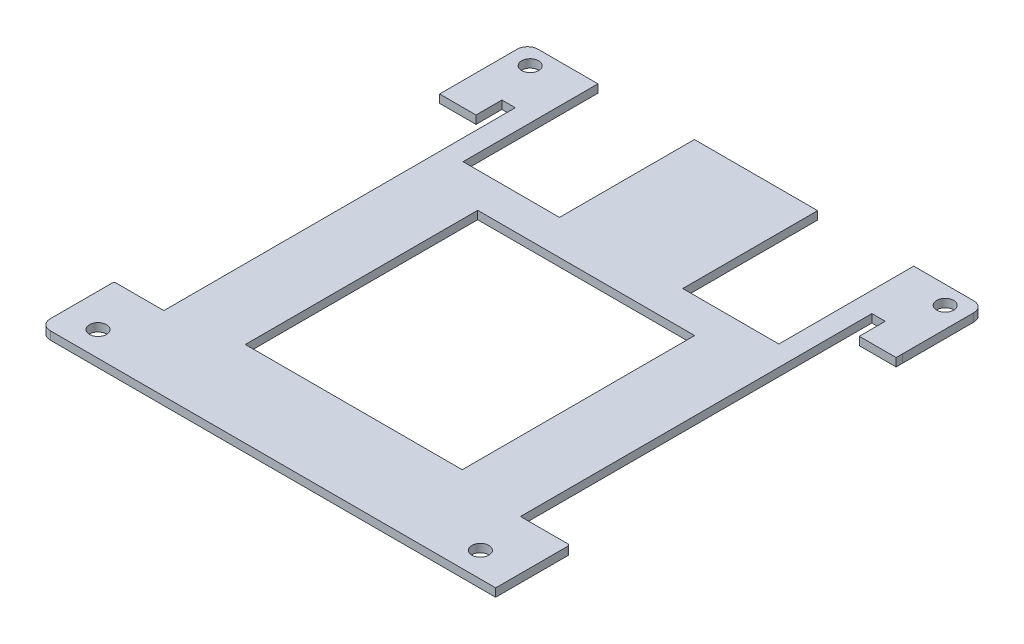
from build123d import *

# Parameters (mm, degrees)
SKETCH1_R                        = 1.6383
BOSS_EXTRUDE1_DEPTH              = 1.575
CUT_EXTRUDE1_DEPTH               = 2.54
CUTOUTS_FOR_THRUSTER_HEADS_DEPTH = 1.575
NOTCH_FOR_BPR_TOP_VIEW_W         = 2.575
NOTCH_FOR_BPR_TOP_VIEW_H         = 6.27
CUT_EXTRUDE11_DEPTH              = 10
NOTCH_FOR_BPL_TOP_VIEW_W         = 2.575
NOTCH_FOR_BPL_TOP_VIEW_H         = 6.27
CUT_EXTRUDE12_DEPTH              = 65.400936523
SKETCH22_W                       = 1.501374709
SKETCH22_H                       = 61.468
SKETCH22_W_2                     = 1.585
BOSS_EXTRUDE2_DEPTH              = 1.575
SKETCH23_W                       = 7.1002401
SKETCH23_H                       = 1.27
SKETCH23_W_2                     = 7.016
CUT_EXTRUDE13_DEPTH              = 65.400936523
SKETCH25_W                       = 2.5
SKETCH25_H                       = 44.79544
BOSS_EXTRUDE3_DEPTH              = 1.575
SKETCH26_W                       = 2.5
SKETCH26_H                       = 44.79544
BOSS_EXTRUDE4_DEPTH              = 1.575
SKETCH27_W                       = 41.818
SKETCH27_H                       = 1
CUT_EXTRUDE15_DEPTH              = 65.400936523
SKETCH28_W                       = 41.818
SKETCH28_H                       = 1
BOSS_EXTRUDE5_DEPTH              = 1.575


with BuildPart() as part:
    # Sketch1 → Boss-Extrude1 (new body)
    with BuildSketch(Plane(origin=(0, 0, 0), x_dir=(1, 0, 0), z_dir=(0, 1, 0))):
        with BuildLine():
            Line((-44, 45), (-44, 29.162404323))
            ThreePointArc((-44, 29.162404323), (-43.886381258, 28.888104416), (-43.612081351, 28.774485674))
            Line((-43.612081351, 28.774485674), (-33.211918649, 28.774485674))
            ThreePointArc((-33.211918649, 28.774485674), (-32.937618742, 28.660866933), (-32.824, 28.386567026))
            Line((-32.824, 28.386567026), (-32.824, -32.305595677))
            ThreePointArc((-32.824, -32.305595677), (-32.937618742, -32.579895584), (-33.211918649, -32.693514326))
            Line((-33.211918649, -32.693514326), (-36.100000052, -32.693514326))
            Line((-36.100000052, -32.693514326), (-43.612081299, -32.693514326))
            ThreePointArc((-43.612081299, -32.693514326), (-43.886381206, -32.807133067), (-43.999999948, -33.081432974))
            Line((-43.999999948, -33.081432974), (-43.999999948, -38.977))
            Line((-43.999999948, -38.977), (-43.999999948, -45))
            ThreePointArc((-43.999999948, -45), (-43.41421351, -46.414213562), (-41.999999948, -47))
            Line((-41.999999948, -47), (42.705916546, -47))
            Line((42.705916546, -47), (43.849731117, -47))
            Line((43.849731117, -47), (43.849731117, -38.27))
            Line((43.849731117, -38.27), (43.849731117, -33.081432974))
            ThreePointArc((43.849731117, -33.081432974), (43.736112376, -32.807133067), (43.461812469, -32.693514326))
            Line((43.461812469, -32.693514326), (36.098785193, -32.693514326))
            Line((36.098785193, -32.693514326), (33.824, -32.693514326))
            Line((33.824, -32.693514326), (32.822785141, -32.693514326))
            Line((32.822785141, -32.693514326), (32.822785141, -30.469351623))
            Line((32.822785141, -30.469351623), (32.822785141, 27.774485674))
            ThreePointArc((32.822785141, 27.774485674), (33.11567836, 28.481592456), (33.822785141, 28.774485674))
            Line((33.822785141, 28.774485674), (43.611054239, 28.774485674))
            ThreePointArc((43.611054239, 28.774485674), (43.885287743, 28.88803803), (43.998972842, 29.162216531))
            Line((43.998972842, 29.162216531), (44, 31.284))
            Line((44, 31.284), (44, 45))
            ThreePointArc((44, 45), (43.414213562, 46.414213562), (42, 47))
            Line((42, 47), (-42, 47))
            ThreePointArc((-42, 47), (-43.414213562, 46.414213562), (-44, 45))
        make_face()
        with Locations(Location((40, 43.5, 0), (0, 0, 270))):
            Circle(SKETCH1_R, mode=Mode.SUBTRACT)
        with Locations(Location((-40, 43.5, 0), (0, 0, 270))):
            Circle(SKETCH1_R, mode=Mode.SUBTRACT)
        with Locations(Location((-37.599999948, -42.2, 0), (0, 0, 270))):
            Circle(SKETCH1_R, mode=Mode.SUBTRACT)
        with Locations(Location((36.100000052, -42.2, 0), (0, 0, 270))):
            Circle(SKETCH1_R, mode=Mode.SUBTRACT)
        Polygon((23.409, -31.5), (-23.409, -31.5), (-23.409, 13.29544), (-12.909, 13.29544), (-12.909, 25.99544), (12.909, 25.99544), (12.909, 13.29544), (23.409, 13.29544), align=None, mode=Mode.SUBTRACT)
    extrude(amount=BOSS_EXTRUDE1_DEPTH)

    # Sketch2 → Cut-Extrude1 (cut)
    with BuildSketch(Plane(origin=(0, 1.575, 0), x_dir=(1, 0, 0), z_dir=(0, 1, 0))):
        Polygon((-12.909, 19.06), (-30.435, 19.06), (-30.435, 47), (30.435, 47), (30.435, 19.06), (12.909, 19.06), (12.909, 25.99544), (-12.909, 25.99544), align=None)
    extrude(amount=-CUT_EXTRUDE1_DEPTH, mode=Mode.SUBTRACT)

    # Sketch16 → Cutouts for Thruster Heads (add)
    with BuildSketch(Plane(origin=(0, 1.575, 0), x_dir=(1, 0, 0), z_dir=(0, 1, 0))):
        Polygon((12.909, 19.06), (12.909, 13.29544), (-12.909, 13.29544), (-12.909, 19.06), (-30.435, 19.06), (-30.435, 21), (-11.838888217, 21), (-11.838888217, 47), (11.909, 47), (11.909, 21), (30.435, 21), (30.435, 19.06), align=None)
    extrude(amount=-CUTOUTS_FOR_THRUSTER_HEADS_DEPTH)

    # Notch for BPR (TOP VIEW) → Cut-Extrude11 (cut)
    with BuildSketch(Plane(origin=(0, 1.575, 0), x_dir=(1, 0, 0), z_dir=(0, 1, 0))):
        with Locations((-35.6965, 31.909485674)):
            Rectangle(NOTCH_FOR_BPR_TOP_VIEW_W, NOTCH_FOR_BPR_TOP_VIEW_H)
    extrude(amount=-CUT_EXTRUDE11_DEPTH, mode=Mode.SUBTRACT)

    # Notch for BPL (TOP VIEW) → Cut-Extrude12 (cut, through all)
    with BuildSketch(Plane(origin=(0, 1.575, 0), x_dir=(1, 0, 0), z_dir=(0, 1, 0))):
        with Locations((35.61165985, 31.909485674)):
            Rectangle(NOTCH_FOR_BPL_TOP_VIEW_W, NOTCH_FOR_BPL_TOP_VIEW_H)
    extrude(amount=-CUT_EXTRUDE12_DEPTH, mode=Mode.SUBTRACT)

    # Sketch22 → Boss-Extrude2 (add)
    with BuildSketch(Plane(origin=(0, 1.575, 0), x_dir=(1, 0, 0), z_dir=(0, 1, 0))):
        with Locations((33.573472495, -1.959514326)):
            Rectangle(SKETCH22_W, SKETCH22_H)
        with Locations((-33.6165, -1.959514326)):
            Rectangle(SKETCH22_W_2, SKETCH22_H)
    extrude(amount=-BOSS_EXTRUDE2_DEPTH)

    # Sketch23 → Cut-Extrude13 (cut, through all)
    with BuildSketch(Plane(origin=(0, 1.575, 0), x_dir=(1, 0, 0), z_dir=(0, 1, 0))):
        with Locations((40.4492799, 29.409485674)):
            Rectangle(SKETCH23_W, SKETCH23_H)
        with Locations((-40.492, 29.409485674)):
            Rectangle(SKETCH23_W_2, SKETCH23_H)
    extrude(amount=-CUT_EXTRUDE13_DEPTH, mode=Mode.SUBTRACT)

    # Sketch25 → Boss-Extrude3 (add)
    with BuildSketch(Plane(origin=(0, 1.575, 0), x_dir=(1, 0, 0), z_dir=(0, 1, 0))):
        with Locations((22.159, -9.10228)):
            Rectangle(SKETCH25_W, SKETCH25_H)
    extrude(amount=-BOSS_EXTRUDE3_DEPTH)

    # Sketch26 → Boss-Extrude4 (add)
    with BuildSketch(Plane(origin=(0, 1.575, 0), x_dir=(1, 0, 0), z_dir=(0, 1, 0))):
        with Locations((-22.159, -9.10228)):
            Rectangle(SKETCH26_W, SKETCH26_H)
    extrude(amount=-BOSS_EXTRUDE4_DEPTH)

    # Sketch27 → Cut-Extrude15 (cut, through all)
    with BuildSketch(Plane(origin=(0, 1.575, 0), x_dir=(1, 0, 0), z_dir=(0, 1, 0))):
        with Locations((0, 13.79544)):
            Rectangle(SKETCH27_W, SKETCH27_H)
    extrude(amount=-CUT_EXTRUDE15_DEPTH, mode=Mode.SUBTRACT)

    # Sketch28 → Boss-Extrude5 (add)
    with BuildSketch(Plane(origin=(0, 1.575, 0), x_dir=(1, 0, 0), z_dir=(0, 1, 0))):
        with Locations((0, -31)):
            Rectangle(SKETCH28_W, SKETCH28_H)
    extrude(amount=-BOSS_EXTRUDE5_DEPTH)


solid = part.part
